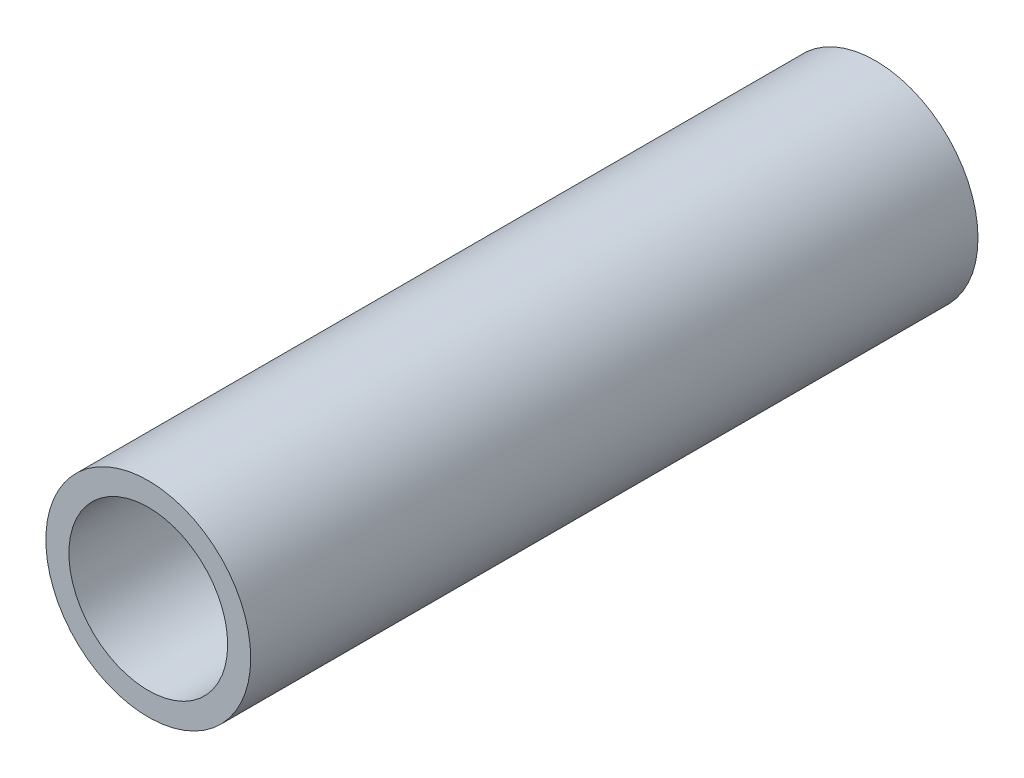
from build123d import *

# Parameters (mm, degrees)
SKETCH_1_R      = 1
SKETCH_1_R_2    = 0.775
EXTRUDE_1_DEPTH = 7.1


with BuildPart() as part:
    # Эскиз1 → Бобышка-Вытянуть1 (new body)
    with BuildSketch(Plane.XY):
        Circle(SKETCH_1_R)
        Circle(SKETCH_1_R_2, mode=Mode.SUBTRACT)
    extrude(amount=EXTRUDE_1_DEPTH)


solid = part.part
